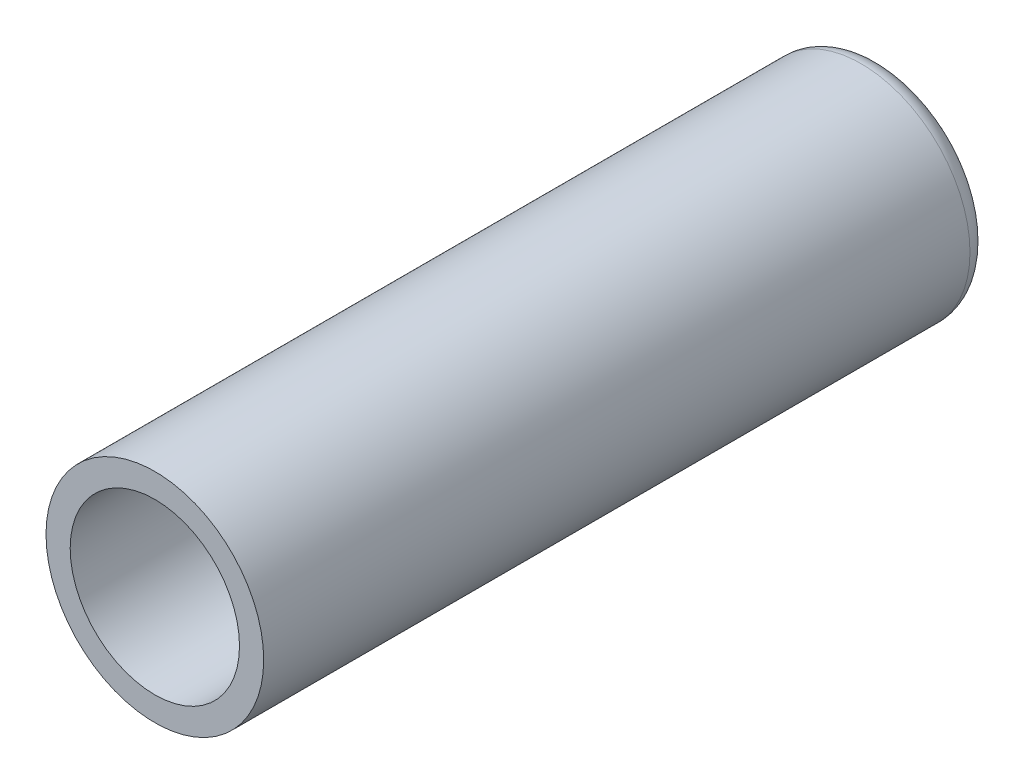
from build123d import *

# Parameters (mm, degrees)
CROQUIS1_R              = 14.2875
SALIENTE_EXTRUIR1_DEPTH = 95.25
CROQUIS2_R              = 11.1125
CORTAR_EXTRUIR1_DEPTH   = 92.075
REDONDEO1_R             = 2.54


with BuildPart() as part:
    # Croquis1 → Saliente-Extruir1 (new body)
    with BuildSketch(Plane.XY):
        Circle(CROQUIS1_R)
    extrude(amount=SALIENTE_EXTRUIR1_DEPTH)

    # Croquis2 → Cortar-Extruir1 (cut)
    with BuildSketch(Plane.XY.offset(95.25)):
        Circle(CROQUIS2_R)
    extrude(amount=-CORTAR_EXTRUIR1_DEPTH, mode=Mode.SUBTRACT)

    # Redondeo1
    redondeo1_edges = [part.edges().sort_by_distance(p)[0] for p in [
        (-14.2875, 0, 0),
    ]]
    fillet(redondeo1_edges, radius=REDONDEO1_R)


solid = part.part
